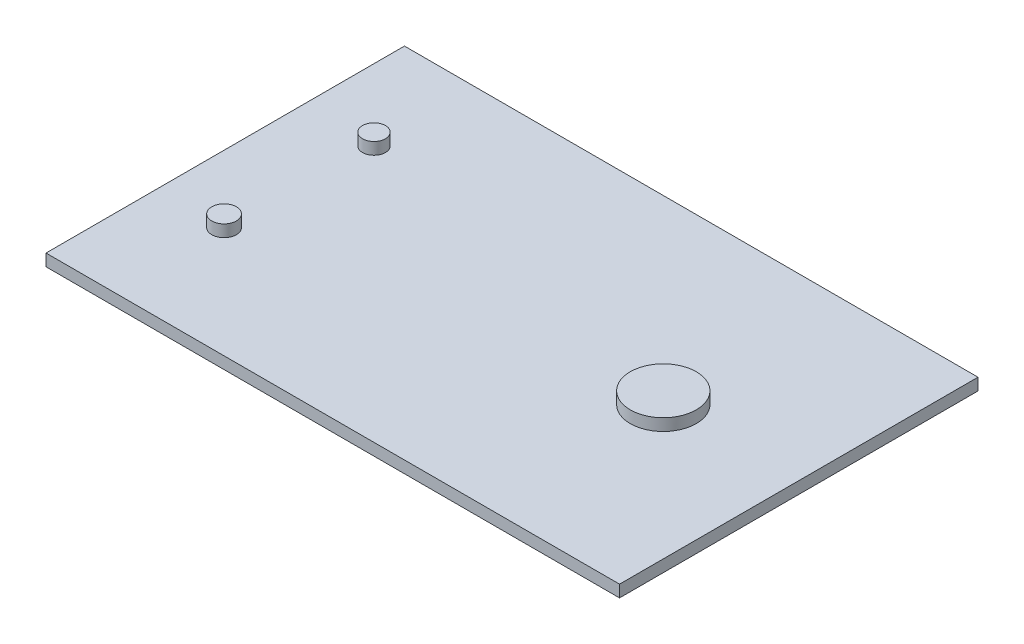
from build123d import *

# Parameters (mm, degrees)
SKETCH1_W           = 60.96
SKETCH1_H           = 38.1
BOSS_EXTRUDE1_DEPTH = 1.27
SKETCH4_R           = 3.508182763
BOSS_EXTRUDE3_DEPTH = 1.27
SKETCH5_R           = 1.218327791
BOSS_EXTRUDE4_DEPTH = 1.27
SKETCH6_R           = 1.306762437
BOSS_EXTRUDE5_DEPTH = 1.27


with BuildPart() as part:
    # Sketch1 → Boss-Extrude1 (new body)
    with BuildSketch(Plane(origin=(0, 0, 0), x_dir=(1, 0, 0), z_dir=(0, 1, 0))):
        with Locations((30.48, 19.05)):
            Rectangle(SKETCH1_W, SKETCH1_H)
    extrude(amount=BOSS_EXTRUDE1_DEPTH)

    # Sketch4 → Boss-Extrude3 (add)
    with BuildSketch(Plane(origin=(0, 1.27, 0), x_dir=(1, 0, 0), z_dir=(0, 1, 0))):
        with Locations(Location((46.755450333, 18.853316636, 0), (0, 0, 90))):
            Circle(SKETCH4_R)
    extrude(amount=BOSS_EXTRUDE3_DEPTH)

    # Sketch5 → Boss-Extrude4 (add)
    with BuildSketch(Plane(origin=(0, 1.27, 0), x_dir=(1, 0, 0), z_dir=(0, 1, 0))):
        with Locations(Location((7.573815533, 27.287225202, 0), (0, 0, 90))):
            Circle(SKETCH5_R)
    extrude(amount=BOSS_EXTRUDE4_DEPTH)

    # Sketch6 → Boss-Extrude5 (add)
    with BuildSketch(Plane(origin=(0, 1.27, 0), x_dir=(1, 0, 0), z_dir=(0, 1, 0))):
        with Locations(Location((7.129145723, 11.797854205, 0), (0, 0, 90))):
            Circle(SKETCH6_R)
    extrude(amount=BOSS_EXTRUDE5_DEPTH)


solid = part.part
